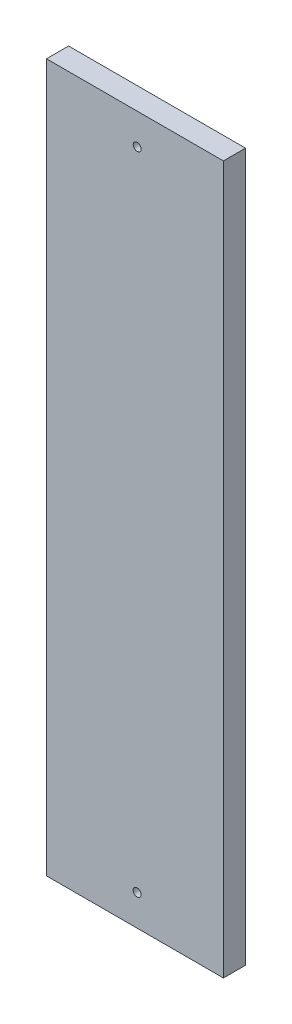
from build123d import *

# Parameters (mm, degrees)
SKETCH1_W           = 50.8
SKETCH1_H           = 6.35
BOSS_EXTRUDE1_DEPTH = 203.2
SKETCH3_R           = 1.1303
CUT_EXTRUDE1_DEPTH  = 205.879775722


with BuildPart() as part:
    # Sketch1 → Boss-Extrude1 (new body)
    with BuildSketch(Plane(origin=(0, 0, 0), x_dir=(1, 0, 0), z_dir=(0, 1, 0))):
        Rectangle(SKETCH1_W, SKETCH1_H)
    extrude(amount=BOSS_EXTRUDE1_DEPTH)

    # Sketch3 → Cut-Extrude1 (cut, through all)
    with BuildSketch(Plane.XY.offset(3.175)):
        with Locations((0.635, 194.31)):
            Circle(SKETCH3_R)
        with Locations(Location((0.635, 8.89, 0), (0, 0, 180))):
            Circle(SKETCH3_R)
    extrude(amount=-CUT_EXTRUDE1_DEPTH, mode=Mode.SUBTRACT)


solid = part.part
